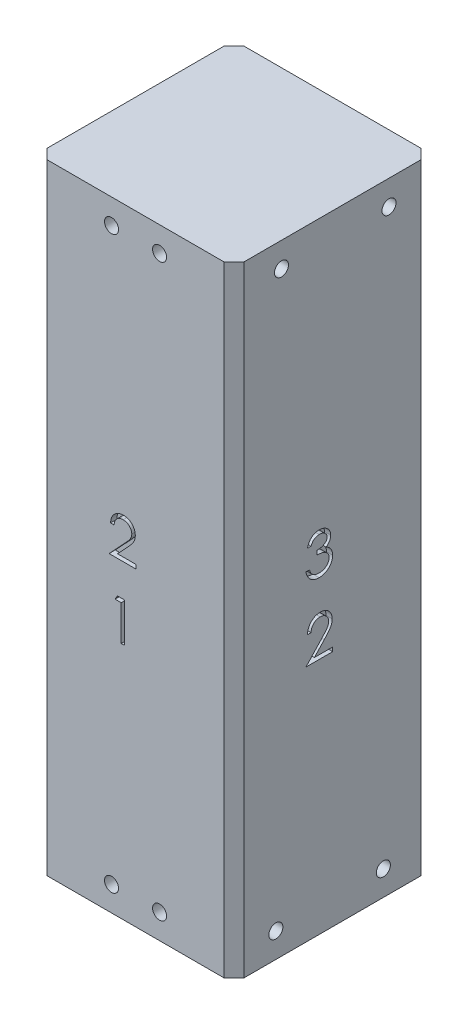
from build123d import *

# Parameters (mm, degrees)
SKETCH1_W           = 31.75
SKETCH1_H           = 31.75
BOSS_EXTRUDE1_DEPTH = 100
CHAMFER1_SIZE       = 1.5875
CUT_EXTRUDE1_DEPTH  = 1
CUT_EXTRUDE2_DEPTH  = 1
CUT_EXTRUDE3_DEPTH  = 1
CUT_EXTRUDE4_DEPTH  = 1
SKETCH6_R           = 1.1303
SKETCH6_R_2         = 0.889
CUT_EXTRUDE5_DEPTH  = 7
SKETCH7_R           = 1.1303
CUT_EXTRUDE6_DEPTH  = 7
SKETCH8_R           = 1.1303
CUT_EXTRUDE7_DEPTH  = 7
CUT_EXTRUDE8_START  = -7
SKETCH9_R           = 1.1303
SKETCH9_R_2         = 0.889
CUT_EXTRUDE8_DEPTH  = 7


with BuildPart() as part:
    # Sketch1 → Boss-Extrude1 (new body)
    with BuildSketch(Plane(origin=(0, 0, 0), x_dir=(1, 0, 0), z_dir=(0, 1, 0))):
        Rectangle(SKETCH1_W, SKETCH1_H)
    extrude(amount=BOSS_EXTRUDE1_DEPTH)

    # Chamfer1
    chamfer1_edges = [part.edges().sort_by_distance(p)[0] for p in [
        (15.875, 50, 15.875),
        (-15.875, 50, 15.875),
        (-15.875, 50, -15.875),
        (15.875, 50, -15.875),
    ]]
    chamfer(chamfer1_edges, length=CHAMFER1_SIZE)

    # Sketch2 → Cut-Extrude1 (cut)
    # profile 1 of 2: a face of its own
    with BuildSketch(Plane.ZY.offset(15.875)):
        Polygon((-2.924409054, 56.35), (-1.750320513, 56.35), (-1.750320513, 50), (-2.320192308, 50), (-2.320192308, 55.698717949), (-3.297115385, 55.698717949), align=None)
    # profile 2 of 2: a face of its own
    with BuildSketch(Plane.ZY.offset(15.875)):
        Polygon((-0.807742388, 44.929487179), (-0.691987179, 44.929487179), (-0.691987179, 40.533333333), (0.040705128, 40.533333333), (0.040705128, 39.882051282), (-0.691987179, 39.882051282), (-0.691987179, 38.416666667), (-1.261858974, 38.416666667), (-1.261858974, 39.882051282), (-4.274038462, 39.882051282), align=None)
        Polygon((-1.261858974, 40.533333333), (-1.261858974, 43.291105769), (-3.154647436, 40.533333333), align=None, mode=Mode.SUBTRACT)
    extrude(amount=-CUT_EXTRUDE1_DEPTH, mode=Mode.SUBTRACT)

    # Sketch3 → Cut-Extrude2 (cut)
    with BuildSketch(Plane.XY.offset(15.875)):
        with BuildLine():
            Line((-3.459935897, 54.396153846), (-4.029807692, 54.396153846))
            add(Edge.make_bspline(
                [(-4.029807692, 54.396153846), (-4.026093572, 54.471756743), (-4.018799138, 54.620238819), (-3.984639242, 54.836726478), (-3.935760793, 55.04365447), (-3.866652012, 55.239361314), (-3.780824908, 55.425577435), (-3.67790043, 55.601563178), (-3.555991587, 55.766647192), (-3.417730798, 55.919299093), (-3.267564839, 56.0593394), (-3.105538349, 56.180271055), (-2.935276656, 56.282447402), (-2.757296318, 56.367866226), (-2.569589296, 56.431982804), (-2.373858968, 56.47955635), (-2.169245392, 56.508179149), (-2.029835638, 56.511255788), (-1.958934295, 56.512820513)],
                knots=[0, 0, 0, 0, 1.10065271, 2.161652631, 3.183658789, 4.190468796, 5.17591951, 6.163126047, 7.15150782, 8.156236427, 9.156009102, 10.134482811, 11.092018607, 12.041330605, 13.001268258, 13.972401359, 14.968799086, 16, 16, 16, 16], degree=3))
            add(Edge.make_bspline(
                [(-1.958934295, 56.512820513), (-1.889305503, 56.511190456), (-1.752487415, 56.507987453), (-1.552803475, 56.480481014), (-1.362707526, 56.437399726), (-1.18257115, 56.376956043), (-1.013831575, 56.295704296), (-0.855221195, 56.19810019), (-0.704851724, 56.085215639), (-0.569493702, 55.952312291), (-0.445200472, 55.810430822), (-0.337972095, 55.658959912), (-0.246145356, 55.50251535), (-0.169604851, 55.339904185), (-0.113260142, 55.169595319), (-0.070482536, 54.994068251), (-0.046302799, 54.811506094), (-0.042591817, 54.687941343), (-0.040705128, 54.625120192)],
                knots=[0, 0, 0, 0, 1.111607364, 2.184268762, 3.212621178, 4.221274766, 5.211760367, 6.196651075, 7.1921475, 8.207485113, 9.220403448, 10.201281604, 11.166441695, 12.114753415, 13.065576456, 14.026450734, 14.996634279, 16, 16, 16, 16], degree=3))
            add(Edge.make_bspline(
                [(-0.040705128, 54.625120192), (-0.043777191, 54.536677692), (-0.049867406, 54.361344733), (-0.101963489, 54.103689197), (-0.183327873, 53.854055422), (-0.281294506, 53.653146317), (-0.380123084, 53.491251264), (-0.469181847, 53.357958042), (-0.573439433, 53.214438121), (-0.694413279, 53.061172094), (-0.829600919, 52.896959452), (-0.980226844, 52.721899395), (-1.147365161, 52.537800613), (-1.264674155, 52.41206045), (-1.325460737, 52.346905048)],
                knots=[0, 0, 0, 0, 1.184426356, 2.348067706, 3.509069118, 4.696110526, 5.333549288, 6.050745305, 6.844228056, 7.710549037, 8.667450064, 9.695053472, 10.805634456, 12, 12, 12, 12], degree=3))
            Line((-1.325460737, 52.346905048), (-2.914232772, 50.651282051))
            Line((-2.914232772, 50.651282051), (0.040705128, 50.651282051))
            Line((0.040705128, 50.651282051), (0.040705128, 50))
            Line((0.040705128, 50), (-4.274038462, 50))
            Line((-4.274038462, 50), (-1.811378205, 52.62802484))
            add(Edge.make_bspline(
                [(-1.811378205, 52.62802484), (-1.751419896, 52.690614624), (-1.636252256, 52.810836792), (-1.473361009, 52.986356162), (-1.327058845, 53.149187472), (-1.196398718, 53.299023067), (-1.084215072, 53.438054626), (-0.984661166, 53.561779302), (-0.904895022, 53.675633805), (-0.818325661, 53.807606061), (-0.734480295, 53.96873698), (-0.662430735, 54.165648102), (-0.618498081, 54.36835326), (-0.61322788, 54.505335527), (-0.610576923, 54.574238782)],
                knots=[0, 0, 0, 0, 1.329631726, 2.553950428, 3.673215718, 4.687767853, 5.603093632, 6.413772471, 7.123043292, 7.734684054, 8.834405432, 9.900288307, 10.943827018, 12, 12, 12, 12], degree=3))
            add(Edge.make_bspline(
                [(-0.610576923, 54.574238782), (-0.611730341, 54.617566462), (-0.614003507, 54.702956999), (-0.63406533, 54.828153162), (-0.664382962, 54.948920753), (-0.707826502, 55.065631247), (-0.765170159, 55.177111216), (-0.834971862, 55.283496359), (-0.91550812, 55.386346338), (-1.008673995, 55.482781608), (-1.111020609, 55.571103223), (-1.219141605, 55.649342636), (-1.333532508, 55.714727879), (-1.453711016, 55.768328224), (-1.579342081, 55.810374987), (-1.71066869, 55.839509839), (-1.847327977, 55.857802345), (-1.940643034, 55.860277343), (-1.988191106, 55.861538462)],
                knots=[0, 0, 0, 0, 0.991446411, 1.95395049, 2.89581595, 3.838931463, 4.798493298, 5.75982156, 6.748411868, 7.785213223, 8.824556874, 9.840280684, 10.836137867, 11.835679398, 12.848801643, 13.863922112, 14.911575587, 16, 16, 16, 16], degree=3))
            add(Edge.make_bspline(
                [(-1.988191106, 55.861538462), (-2.037849617, 55.860241189), (-2.135370733, 55.857693559), (-2.278552407, 55.83987244), (-2.415142317, 55.809127844), (-2.545484056, 55.767078735), (-2.669798161, 55.71363251), (-2.78748007, 55.647063202), (-2.898265597, 55.567627436), (-3.002363004, 55.477565284), (-3.098273366, 55.377294065), (-3.182541269, 55.265515989), (-3.256172266, 55.144271964), (-3.320414733, 55.013889136), (-3.372585771, 54.873184421), (-3.412451344, 54.722657299), (-3.443996051, 54.562961365), (-3.454534367, 54.452679853), (-3.459935897, 54.396153846)],
                knots=[0, 0, 0, 0, 1.031018746, 2.02475058, 2.990194455, 3.934040569, 4.864654155, 5.795059489, 6.735614925, 7.690564532, 8.649604399, 9.611025574, 10.590972636, 11.591080095, 12.624614302, 13.701020113, 14.821632451, 16, 16, 16, 16], degree=3))
        make_face()
        Polygon((-2.924409054, 44.766666667), (-1.750320513, 44.766666667), (-1.750320513, 38.416666667), (-2.320192308, 38.416666667), (-2.320192308, 44.115384615), (-3.297115385, 44.115384615), align=None)
    extrude(amount=-CUT_EXTRUDE2_DEPTH, mode=Mode.SUBTRACT)

    # Sketch4 → Cut-Extrude3 (cut)
    with BuildSketch(Plane(origin=(15.875, 0, 0), x_dir=(0, 0, -1), z_dir=(1, 0, 0))):
        with BuildLine():
            Line((-3.459935897, 54.884615385), (-4.029807692, 54.884615385))
            add(Edge.make_bspline(
                [(-4.029807692, 54.884615385), (-4.014368936, 54.948537177), (-3.98418743, 55.073499053), (-3.921236119, 55.25203794), (-3.85265747, 55.420990615), (-3.770308666, 55.577193491), (-3.68048564, 55.723785786), (-3.577574417, 55.857442626), (-3.46632292, 55.981563292), (-3.343269084, 56.091714452), (-3.214221369, 56.191459761), (-3.077361416, 56.276504507), (-2.935442738, 56.349664042), (-2.787482053, 56.409935034), (-2.633038856, 56.455338484), (-2.473509397, 56.488280117), (-2.308475618, 56.509672567), (-2.196447847, 56.51176038), (-2.139563301, 56.512820513)],
                knots=[0, 0, 0, 0, 1.162005537, 2.271625781, 3.343758855, 4.383309926, 5.390229558, 6.379919256, 7.361854164, 8.333198761, 9.295911338, 10.242430842, 11.177959212, 12.116337295, 13.062827104, 14.020064771, 14.994644689, 16, 16, 16, 16], degree=3))
            add(Edge.make_bspline(
                [(-2.139563301, 56.512820513), (-2.056681755, 56.510318195), (-1.892726549, 56.505368142), (-1.65185645, 56.460166236), (-1.419579221, 56.388637782), (-1.1984373, 56.289806877), (-0.993026715, 56.167909894), (-0.810262491, 56.022831015), (-0.652621907, 55.857369425), (-0.520370679, 55.674611772), (-0.416820323, 55.47929392), (-0.340463617, 55.278270777), (-0.293978567, 55.072019201), (-0.287954128, 54.932759566), (-0.284935897, 54.862990785)],
                knots=[0, 0, 0, 0, 1.083050992, 2.142477498, 3.193116406, 4.255571735, 5.30263384, 6.308962982, 7.297363603, 8.282367274, 9.249857812, 10.179914175, 11.08814088, 12, 12, 12, 12], degree=3))
            add(Edge.make_bspline(
                [(-0.284935897, 54.862990785), (-0.287046984, 54.795849886), (-0.291178053, 54.664465566), (-0.326254919, 54.472656564), (-0.385284996, 54.291878232), (-0.467054422, 54.121369552), (-0.572902663, 53.962211629), (-0.701123128, 53.814046369), (-0.852620814, 53.676216611), (-0.967426887, 53.597259853), (-1.026532452, 53.556610577)],
                knots=[0, 0, 0, 0, 1.024540389, 2.004866551, 2.965041327, 3.920577974, 4.882998113, 5.874504559, 6.905732034, 8, 8, 8, 8], degree=3))
            add(Edge.make_bspline(
                [(-1.026532452, 53.556610577), (-0.958983411, 53.523993037), (-0.825149225, 53.459368257), (-0.642721836, 53.332629954), (-0.477117691, 53.186296295), (-0.384763801, 53.072100339), (-0.338361378, 53.014723558)],
                knots=[0, 0, 0, 0, 1.015518401, 2.012035669, 3.001164323, 4, 4, 4, 4], degree=3))
            add(Edge.make_bspline(
                [(-0.338361378, 53.014723558), (-0.307806371, 52.972890208), (-0.247196717, 52.88990856), (-0.172383677, 52.756492473), (-0.104512856, 52.621597628), (-0.051626029, 52.48160842), (-0.010670585, 52.338147381), (0.018604788, 52.190968176), (0.036791443, 52.039950621), (0.039395945, 51.937783693), (0.040705128, 51.886428285)],
                knots=[0, 0, 0, 0, 1.025084078, 2.033381695, 3.024893161, 4.013698104, 4.991890475, 5.976764909, 6.982997093, 8, 8, 8, 8], degree=3))
            add(Edge.make_bspline(
                [(0.040705128, 51.886428285), (0.037449368, 51.797510648), (0.030953169, 51.620093822), (-0.027111366, 51.357975399), (-0.11712396, 51.101751987), (-0.244952972, 50.856687636), (-0.400741166, 50.627397516), (-0.58608374, 50.422244784), (-0.798874796, 50.245898745), (-1.036193616, 50.098560188), (-1.293308977, 49.980780529), (-1.568310409, 49.899033454), (-1.857235506, 49.845791427), (-2.055368746, 49.840082107), (-2.15609976, 49.837179487)],
                knots=[0, 0, 0, 0, 0.955779014, 1.907060117, 2.875433937, 3.871313158, 4.872415639, 5.851225146, 6.836215519, 7.83643374, 8.849228613, 9.86973379, 10.916971861, 12, 12, 12, 12], degree=3))
            add(Edge.make_bspline(
                [(-2.15609976, 49.837179487), (-2.223989062, 49.838754674), (-2.357572569, 49.841854117), (-2.553957202, 49.863042436), (-2.741412285, 49.90174116), (-2.92019127, 49.953817157), (-3.090452979, 50.019842174), (-3.251677855, 50.102063241), (-3.404857805, 50.198785537), (-3.548547331, 50.311150761), (-3.682729304, 50.436846906), (-3.803837817, 50.578105396), (-3.913892013, 50.732314971), (-4.009945086, 50.901266802), (-4.096372129, 51.082777483), (-4.167457579, 51.279171187), (-4.230024253, 51.488692198), (-4.259113539, 51.634701813), (-4.274038462, 51.709615385)],
                knots=[0, 0, 0, 0, 1.048658725, 2.063410685, 3.046034179, 4.001477787, 4.936774919, 5.862367409, 6.792675028, 7.730719943, 8.675894397, 9.627829632, 10.600096036, 11.597688215, 12.626045268, 13.701542398, 14.82072376, 16, 16, 16, 16], degree=3))
            Line((-4.274038462, 51.709615385), (-3.704166667, 51.709615385))
            add(Edge.make_bspline(
                [(-3.704166667, 51.709615385), (-3.689319838, 51.660722175), (-3.660441466, 51.565620635), (-3.611284669, 51.428750366), (-3.555280803, 51.303277898), (-3.495201533, 51.188282805), (-3.432103495, 51.082632589), (-3.361500702, 50.989120913), (-3.288622396, 50.903640474), (-3.233686998, 50.855480964), (-3.206800881, 50.831911058)],
                knots=[0, 0, 0, 0, 1.198163088, 2.33053128, 3.407730985, 4.417276592, 5.372219308, 6.28897303, 7.162600585, 8, 8, 8, 8], degree=3))
            add(Edge.make_bspline(
                [(-3.206800881, 50.831911058), (-3.171247093, 50.804500223), (-3.100249261, 50.749763166), (-2.984555471, 50.679910211), (-2.862880606, 50.619383779), (-2.732588268, 50.573149074), (-2.596490042, 50.534001033), (-2.452386108, 50.508382376), (-2.301547814, 50.490805266), (-2.198554872, 50.489254176), (-2.145923478, 50.488461538)],
                knots=[0, 0, 0, 0, 0.946170439, 1.889420265, 2.845303464, 3.807233317, 4.801018734, 5.828864929, 6.890507805, 8, 8, 8, 8], degree=3))
            add(Edge.make_bspline(
                [(-2.145923478, 50.488461538), (-2.086499266, 50.489578967), (-1.970300349, 50.491764001), (-1.800746533, 50.511858497), (-1.639443021, 50.541123676), (-1.488180713, 50.586322945), (-1.344978221, 50.642168204), (-1.211842942, 50.712287454), (-1.087027149, 50.794555735), (-0.972129514, 50.888062494), (-0.868814093, 50.990427206), (-0.777846691, 51.097493778), (-0.700513376, 51.208810783), (-0.638131741, 51.324994231), (-0.588872886, 51.445563003), (-0.555339079, 51.570855451), (-0.532022759, 51.699846205), (-0.530123905, 51.787528763), (-0.529166667, 51.831730769)],
                knots=[0, 0, 0, 0, 1.217147791, 2.380027433, 3.494444702, 4.572153297, 5.609568379, 6.639424714, 7.649109417, 8.668170816, 9.669597737, 10.625200337, 11.543417969, 12.441394052, 13.322311151, 14.205496177, 15.095365482, 16, 16, 16, 16], degree=3))
            add(Edge.make_bspline(
                [(-0.529166667, 51.831730769), (-0.531943071, 51.890897055), (-0.537482064, 52.008935225), (-0.579770487, 52.182594252), (-0.649328141, 52.349913872), (-0.746705411, 52.508039377), (-0.86524309, 52.654589941), (-1.00379085, 52.785348202), (-1.163499207, 52.893243939), (-1.310492398, 52.967790501), (-1.440694896, 53.018657766), (-1.552119951, 53.052539487), (-1.676864074, 53.081229977), (-1.813418736, 53.107922241), (-1.962812857, 53.130639544), (-2.124883794, 53.149583981), (-2.29966439, 53.164742413), (-2.42066122, 53.171511685), (-2.483012821, 53.175)],
                knots=[0, 0, 0, 0, 1.07054697, 2.135767047, 3.216561865, 4.33974944, 5.486079747, 6.621378074, 7.775625952, 8.963672916, 9.598146892, 10.304877434, 11.070270905, 11.915000392, 12.823868403, 13.805723172, 14.86925407, 16, 16, 16, 16], degree=3))
            Line((-2.483012821, 53.175), (-2.483012821, 53.826282051))
            add(Edge.make_bspline(
                [(-2.483012821, 53.826282051), (-2.404452134, 53.827615195), (-2.250571048, 53.830226497), (-2.025791381, 53.861809601), (-1.810846943, 53.905498741), (-1.610501283, 53.972419018), (-1.42789576, 54.050143557), (-1.269473053, 54.140589708), (-1.137452658, 54.241127896), (-1.032476142, 54.353309916), (-0.953501685, 54.473624359), (-0.895758781, 54.599021724), (-0.861649617, 54.730601092), (-0.857096364, 54.820398561), (-0.854807692, 54.865534856)],
                knots=[0, 0, 0, 0, 1.321986639, 2.589447074, 3.816329219, 5.01088745, 6.139805852, 7.153945165, 8.075214402, 8.924034688, 9.728124013, 10.488707548, 11.240355623, 12, 12, 12, 12], degree=3))
            add(Edge.make_bspline(
                [(-0.854807692, 54.865534856), (-0.855559552, 54.898695908), (-0.857055342, 54.964668248), (-0.875918974, 55.061052301), (-0.904265449, 55.154489731), (-0.943235815, 55.244583187), (-0.99539689, 55.330707827), (-1.057819179, 55.413597913), (-1.132147018, 55.492780198), (-1.217319472, 55.56658592), (-1.30878089, 55.636924393), (-1.409019767, 55.696639135), (-1.51501374, 55.747702319), (-1.626880157, 55.789810987), (-1.744982048, 55.821487124), (-1.868764516, 55.844230722), (-1.998463599, 55.858450467), (-2.086949456, 55.860497736), (-2.13193109, 55.861538462)],
                knots=[0, 0, 0, 0, 0.884392785, 1.759457502, 2.611959086, 3.489218968, 4.37281399, 5.2945488, 6.255912374, 7.266815255, 8.301784654, 9.332968512, 10.37626691, 11.440494194, 12.520033166, 13.637162961, 14.798855837, 16, 16, 16, 16], degree=3))
            add(Edge.make_bspline(
                [(-2.13193109, 55.861538462), (-2.204233402, 55.859014133), (-2.345456633, 55.854083533), (-2.549046554, 55.810898066), (-2.738311631, 55.741994972), (-2.882980355, 55.659747922), (-2.989810168, 55.578557849), (-3.066149756, 55.507651234), (-3.141116968, 55.428851682), (-3.209779838, 55.337305773), (-3.279219768, 55.239213168), (-3.342437758, 55.129587346), (-3.403868914, 55.011287945), (-3.440884968, 54.927657293), (-3.459935897, 54.884615385)],
                knots=[0, 0, 0, 0, 1.472543308, 2.876219568, 4.221790263, 5.565193594, 6.249813518, 6.953379497, 7.687249741, 8.463570142, 9.283606569, 10.136032583, 11.040678096, 12, 12, 12, 12], degree=3))
        make_face()
        with BuildLine():
            Line((-3.459935897, 42.812820513), (-4.029807692, 42.812820513))
            add(Edge.make_bspline(
                [(-4.029807692, 42.812820513), (-4.026093572, 42.888423409), (-4.018799138, 43.036905486), (-3.984639242, 43.253393144), (-3.935760793, 43.460321136), (-3.866652012, 43.65602798), (-3.780824908, 43.842244102), (-3.67790043, 44.018229845), (-3.555991587, 44.183313859), (-3.417730798, 44.33596576), (-3.267564839, 44.476006067), (-3.105538349, 44.596937722), (-2.935276656, 44.699114068), (-2.757296318, 44.784532893), (-2.569589296, 44.84864947), (-2.373858968, 44.896223017), (-2.169245392, 44.924845815), (-2.029835638, 44.927922455), (-1.958934295, 44.929487179)],
                knots=[0, 0, 0, 0, 1.10065271, 2.161652631, 3.183658789, 4.190468796, 5.17591951, 6.163126047, 7.15150782, 8.156236427, 9.156009102, 10.134482811, 11.092018607, 12.041330605, 13.001268258, 13.972401359, 14.968799086, 16, 16, 16, 16], degree=3))
            add(Edge.make_bspline(
                [(-1.958934295, 44.929487179), (-1.889305503, 44.927857123), (-1.752487415, 44.92465412), (-1.552803475, 44.897147681), (-1.362707526, 44.854066393), (-1.18257115, 44.793622709), (-1.013831575, 44.712370962), (-0.855221195, 44.614766857), (-0.704851724, 44.501882305), (-0.569493702, 44.368978958), (-0.445200472, 44.227097489), (-0.337972095, 44.075626578), (-0.246145356, 43.919182017), (-0.169604851, 43.756570851), (-0.113260142, 43.586261985), (-0.070482536, 43.410734918), (-0.046302799, 43.22817276), (-0.042591817, 43.10460801), (-0.040705128, 43.041786859)],
                knots=[0, 0, 0, 0, 1.111607364, 2.184268762, 3.212621178, 4.221274766, 5.211760367, 6.196651075, 7.1921475, 8.207485113, 9.220403448, 10.201281604, 11.166441695, 12.114753415, 13.065576456, 14.026450734, 14.996634279, 16, 16, 16, 16], degree=3))
            add(Edge.make_bspline(
                [(-0.040705128, 43.041786859), (-0.043777191, 42.953344359), (-0.049867406, 42.7780114), (-0.101963489, 42.520355863), (-0.183327873, 42.270722089), (-0.281294506, 42.069812983), (-0.380123084, 41.907917931), (-0.469181847, 41.774624709), (-0.573439433, 41.631104788), (-0.694413279, 41.477838761), (-0.829600919, 41.313626119), (-0.980226844, 41.138566062), (-1.147365161, 40.954467279), (-1.264674155, 40.828727117), (-1.325460737, 40.763571715)],
                knots=[0, 0, 0, 0, 1.184426356, 2.348067706, 3.509069118, 4.696110526, 5.333549288, 6.050745305, 6.844228056, 7.710549037, 8.667450064, 9.695053472, 10.805634456, 12, 12, 12, 12], degree=3))
            Line((-1.325460737, 40.763571715), (-2.914232772, 39.067948718))
            Line((-2.914232772, 39.067948718), (0.040705128, 39.067948718))
            Line((0.040705128, 39.067948718), (0.040705128, 38.416666667))
            Line((0.040705128, 38.416666667), (-4.274038462, 38.416666667))
            Line((-4.274038462, 38.416666667), (-1.811378205, 41.044691506))
            add(Edge.make_bspline(
                [(-1.811378205, 41.044691506), (-1.751419896, 41.107281291), (-1.636252256, 41.227503458), (-1.473361009, 41.403022829), (-1.327058845, 41.565854138), (-1.196398718, 41.715689733), (-1.084215072, 41.854721292), (-0.984661166, 41.978445969), (-0.904895022, 42.092300471), (-0.818325661, 42.224272728), (-0.734480295, 42.385403646), (-0.662430735, 42.582314768), (-0.618498081, 42.785019927), (-0.61322788, 42.922002194), (-0.610576923, 42.990905449)],
                knots=[0, 0, 0, 0, 1.329631726, 2.553950428, 3.673215718, 4.687767853, 5.603093632, 6.413772471, 7.123043292, 7.734684054, 8.834405432, 9.900288307, 10.943827018, 12, 12, 12, 12], degree=3))
            add(Edge.make_bspline(
                [(-0.610576923, 42.990905449), (-0.611730341, 43.034233129), (-0.614003507, 43.119623666), (-0.63406533, 43.244819829), (-0.664382962, 43.365587419), (-0.707826502, 43.482297914), (-0.765170159, 43.593777883), (-0.834971862, 43.700163025), (-0.91550812, 43.803013005), (-1.008673995, 43.899448274), (-1.111020609, 43.98776989), (-1.219141605, 44.066009302), (-1.333532508, 44.131394546), (-1.453711016, 44.184994891), (-1.579342081, 44.227041654), (-1.71066869, 44.256176505), (-1.847327977, 44.274469012), (-1.940643034, 44.276944009), (-1.988191106, 44.278205128)],
                knots=[0, 0, 0, 0, 0.991446411, 1.95395049, 2.89581595, 3.838931463, 4.798493298, 5.75982156, 6.748411868, 7.785213223, 8.824556874, 9.840280684, 10.836137867, 11.835679398, 12.848801643, 13.863922112, 14.911575587, 16, 16, 16, 16], degree=3))
            add(Edge.make_bspline(
                [(-1.988191106, 44.278205128), (-2.037849617, 44.276907855), (-2.135370733, 44.274360226), (-2.278552407, 44.256539107), (-2.415142317, 44.225794511), (-2.545484056, 44.183745401), (-2.669798161, 44.130299177), (-2.78748007, 44.063729869), (-2.898265597, 43.984294103), (-3.002363004, 43.894231951), (-3.098273366, 43.793960731), (-3.182541269, 43.682182655), (-3.256172266, 43.56093863), (-3.320414733, 43.430555803), (-3.372585771, 43.289851088), (-3.412451344, 43.139323966), (-3.443996051, 42.979628031), (-3.454534367, 42.86934652), (-3.459935897, 42.812820513)],
                knots=[0, 0, 0, 0, 1.031018746, 2.02475058, 2.990194455, 3.934040569, 4.864654155, 5.795059489, 6.735614925, 7.690564532, 8.649604399, 9.611025574, 10.590972636, 11.591080095, 12.624614302, 13.701020113, 14.821632451, 16, 16, 16, 16], degree=3))
        make_face()
    extrude(amount=-CUT_EXTRUDE3_DEPTH, mode=Mode.SUBTRACT)

    # Sketch5 → Cut-Extrude4 (cut)
    # profile 1 of 2: a face of its own
    with BuildSketch(Plane(origin=(0, 0, -15.875), x_dir=(-1, 0, 0), z_dir=(0, 0, -1))):
        Polygon((-0.807742388, 56.512820513), (-0.691987179, 56.512820513), (-0.691987179, 52.116666667), (0.040705128, 52.116666667), (0.040705128, 51.465384615), (-0.691987179, 51.465384615), (-0.691987179, 50), (-1.261858974, 50), (-1.261858974, 51.465384615), (-4.274038462, 51.465384615), align=None)
        Polygon((-1.261858974, 52.116666667), (-1.261858974, 54.874439103), (-3.154647436, 52.116666667), align=None, mode=Mode.SUBTRACT)
    # profile 2 of 2: a face of its own
    with BuildSketch(Plane(origin=(0, 0, -15.875), x_dir=(-1, 0, 0), z_dir=(0, 0, -1))):
        with BuildLine():
            Line((-3.459935897, 43.301282051), (-4.029807692, 43.301282051))
            add(Edge.make_bspline(
                [(-4.029807692, 43.301282051), (-4.014368936, 43.365203844), (-3.98418743, 43.490165719), (-3.921236119, 43.668704607), (-3.85265747, 43.837657281), (-3.770308666, 43.993860158), (-3.68048564, 44.140452453), (-3.577574417, 44.274109293), (-3.46632292, 44.398229959), (-3.343269084, 44.508381118), (-3.214221369, 44.608126427), (-3.077361416, 44.693171174), (-2.935442738, 44.766330709), (-2.787482053, 44.826601701), (-2.633038856, 44.872005151), (-2.473509397, 44.904946784), (-2.308475618, 44.926339234), (-2.196447847, 44.928427047), (-2.139563301, 44.929487179)],
                knots=[0, 0, 0, 0, 1.162005537, 2.271625781, 3.343758855, 4.383309926, 5.390229558, 6.379919256, 7.361854164, 8.333198761, 9.295911338, 10.242430842, 11.177959212, 12.116337295, 13.062827104, 14.020064771, 14.994644689, 16, 16, 16, 16], degree=3))
            add(Edge.make_bspline(
                [(-2.139563301, 44.929487179), (-2.056681755, 44.926984862), (-1.892726549, 44.922034809), (-1.65185645, 44.876832903), (-1.419579221, 44.805304449), (-1.1984373, 44.706473544), (-0.993026715, 44.584576561), (-0.810262491, 44.439497681), (-0.652621907, 44.274036091), (-0.520370679, 44.091278439), (-0.416820323, 43.895960586), (-0.340463617, 43.694937444), (-0.293978567, 43.488685867), (-0.287954128, 43.349426232), (-0.284935897, 43.279657452)],
                knots=[0, 0, 0, 0, 1.083050992, 2.142477498, 3.193116406, 4.255571735, 5.30263384, 6.308962982, 7.297363603, 8.282367274, 9.249857812, 10.179914175, 11.08814088, 12, 12, 12, 12], degree=3))
            add(Edge.make_bspline(
                [(-0.284935897, 43.279657452), (-0.287046984, 43.212516553), (-0.291178053, 43.081132233), (-0.326254919, 42.889323231), (-0.385284996, 42.708544899), (-0.467054422, 42.538036219), (-0.572902663, 42.378878295), (-0.701123128, 42.230713036), (-0.852620814, 42.092883278), (-0.967426887, 42.01392652), (-1.026532452, 41.973277244)],
                knots=[0, 0, 0, 0, 1.024540389, 2.004866551, 2.965041327, 3.920577974, 4.882998113, 5.874504559, 6.905732034, 8, 8, 8, 8], degree=3))
            add(Edge.make_bspline(
                [(-1.026532452, 41.973277244), (-0.958983411, 41.940659704), (-0.825149225, 41.876034924), (-0.642721836, 41.749296621), (-0.477117691, 41.602962962), (-0.384763801, 41.488767006), (-0.338361378, 41.431390224)],
                knots=[0, 0, 0, 0, 1.015518401, 2.012035669, 3.001164323, 4, 4, 4, 4], degree=3))
            add(Edge.make_bspline(
                [(-0.338361378, 41.431390224), (-0.307806371, 41.389556875), (-0.247196717, 41.306575226), (-0.172383677, 41.173159139), (-0.104512856, 41.038264295), (-0.051626029, 40.898275087), (-0.010670585, 40.754814047), (0.018604788, 40.607634843), (0.036791443, 40.456617288), (0.039395945, 40.35445036), (0.040705128, 40.303094952)],
                knots=[0, 0, 0, 0, 1.025084078, 2.033381695, 3.024893161, 4.013698104, 4.991890475, 5.976764909, 6.982997093, 8, 8, 8, 8], degree=3))
            add(Edge.make_bspline(
                [(0.040705128, 40.303094952), (0.037449368, 40.214177315), (0.030953169, 40.036760489), (-0.027111366, 39.774642065), (-0.11712396, 39.518418654), (-0.244952972, 39.273354303), (-0.400741166, 39.044064183), (-0.58608374, 38.838911451), (-0.798874796, 38.662565411), (-1.036193616, 38.515226855), (-1.293308977, 38.397447196), (-1.568310409, 38.315700121), (-1.857235506, 38.262458093), (-2.055368746, 38.256748774), (-2.15609976, 38.253846154)],
                knots=[0, 0, 0, 0, 0.955779014, 1.907060117, 2.875433937, 3.871313158, 4.872415639, 5.851225146, 6.836215519, 7.83643374, 8.849228613, 9.86973379, 10.916971861, 12, 12, 12, 12], degree=3))
            add(Edge.make_bspline(
                [(-2.15609976, 38.253846154), (-2.223989062, 38.255421341), (-2.357572569, 38.258520783), (-2.553957202, 38.279709103), (-2.741412285, 38.318407826), (-2.92019127, 38.370483823), (-3.090452979, 38.436508841), (-3.251677855, 38.518729908), (-3.404857805, 38.615452204), (-3.548547331, 38.727817428), (-3.682729304, 38.853513573), (-3.803837817, 38.994772062), (-3.913892013, 39.148981638), (-4.009945086, 39.317933468), (-4.096372129, 39.499444149), (-4.167457579, 39.695837854), (-4.230024253, 39.905358865), (-4.259113539, 40.051368479), (-4.274038462, 40.126282051)],
                knots=[0, 0, 0, 0, 1.048658725, 2.063410685, 3.046034179, 4.001477787, 4.936774919, 5.862367409, 6.792675028, 7.730719943, 8.675894397, 9.627829632, 10.600096036, 11.597688215, 12.626045268, 13.701542398, 14.82072376, 16, 16, 16, 16], degree=3))
            Line((-4.274038462, 40.126282051), (-3.704166667, 40.126282051))
            add(Edge.make_bspline(
                [(-3.704166667, 40.126282051), (-3.689319838, 40.077388841), (-3.660441466, 39.982287302), (-3.611284669, 39.845417033), (-3.555280803, 39.719944565), (-3.495201533, 39.604949472), (-3.432103495, 39.499299256), (-3.361500702, 39.405787579), (-3.288622396, 39.320307141), (-3.233686998, 39.272147631), (-3.206800881, 39.248577724)],
                knots=[0, 0, 0, 0, 1.198163088, 2.33053128, 3.407730985, 4.417276592, 5.372219308, 6.28897303, 7.162600585, 8, 8, 8, 8], degree=3))
            add(Edge.make_bspline(
                [(-3.206800881, 39.248577724), (-3.171247093, 39.22116689), (-3.100249261, 39.166429832), (-2.984555471, 39.096576878), (-2.862880606, 39.036050446), (-2.732588268, 38.989815741), (-2.596490042, 38.950667699), (-2.452386108, 38.925049043), (-2.301547814, 38.907471932), (-2.198554872, 38.905920842), (-2.145923478, 38.905128205)],
                knots=[0, 0, 0, 0, 0.946170439, 1.889420265, 2.845303464, 3.807233317, 4.801018734, 5.828864929, 6.890507805, 8, 8, 8, 8], degree=3))
            add(Edge.make_bspline(
                [(-2.145923478, 38.905128205), (-2.086499266, 38.906245633), (-1.970300349, 38.908430667), (-1.800746533, 38.928525164), (-1.639443021, 38.957790343), (-1.488180713, 39.002989612), (-1.344978221, 39.058834871), (-1.211842942, 39.128954121), (-1.087027149, 39.211222401), (-0.972129514, 39.30472916), (-0.868814093, 39.407093873), (-0.777846691, 39.514160445), (-0.700513376, 39.62547745), (-0.638131741, 39.741660898), (-0.588872886, 39.86222967), (-0.555339079, 39.987522118), (-0.532022759, 40.116512872), (-0.530123905, 40.20419543), (-0.529166667, 40.248397436)],
                knots=[0, 0, 0, 0, 1.217147791, 2.380027433, 3.494444702, 4.572153297, 5.609568379, 6.639424714, 7.649109417, 8.668170816, 9.669597737, 10.625200337, 11.543417969, 12.441394052, 13.322311151, 14.205496177, 15.095365482, 16, 16, 16, 16], degree=3))
            add(Edge.make_bspline(
                [(-0.529166667, 40.248397436), (-0.531943071, 40.307563722), (-0.537482064, 40.425601891), (-0.579770487, 40.599260919), (-0.649328141, 40.766580539), (-0.746705411, 40.924706044), (-0.86524309, 41.071256608), (-1.00379085, 41.202014869), (-1.163499207, 41.309910605), (-1.310492398, 41.384457168), (-1.440694896, 41.435324433), (-1.552119951, 41.469206154), (-1.676864074, 41.497896644), (-1.813418736, 41.524588908), (-1.962812857, 41.547306211), (-2.124883794, 41.566250648), (-2.29966439, 41.581409079), (-2.42066122, 41.588178352), (-2.483012821, 41.591666667)],
                knots=[0, 0, 0, 0, 1.07054697, 2.135767047, 3.216561865, 4.33974944, 5.486079747, 6.621378074, 7.775625952, 8.963672916, 9.598146892, 10.304877434, 11.070270905, 11.915000392, 12.823868403, 13.805723172, 14.86925407, 16, 16, 16, 16], degree=3))
            Line((-2.483012821, 41.591666667), (-2.483012821, 42.242948718))
            add(Edge.make_bspline(
                [(-2.483012821, 42.242948718), (-2.404452134, 42.244281862), (-2.250571048, 42.246893163), (-2.025791381, 42.278476268), (-1.810846943, 42.322165407), (-1.610501283, 42.389085685), (-1.42789576, 42.466810223), (-1.269473053, 42.557256375), (-1.137452658, 42.657794563), (-1.032476142, 42.769976583), (-0.953501685, 42.890291026), (-0.895758781, 43.015688391), (-0.861649617, 43.147267758), (-0.857096364, 43.237065227), (-0.854807692, 43.282201522)],
                knots=[0, 0, 0, 0, 1.321986639, 2.589447074, 3.816329219, 5.01088745, 6.139805852, 7.153945165, 8.075214402, 8.924034688, 9.728124013, 10.488707548, 11.240355623, 12, 12, 12, 12], degree=3))
            add(Edge.make_bspline(
                [(-0.854807692, 43.282201522), (-0.855559552, 43.315362574), (-0.857055342, 43.381334914), (-0.875918974, 43.477718968), (-0.904265449, 43.571156398), (-0.943235815, 43.661249854), (-0.99539689, 43.747374494), (-1.057819179, 43.830264579), (-1.132147018, 43.909446864), (-1.217319472, 43.983252587), (-1.30878089, 44.05359106), (-1.409019767, 44.113305801), (-1.51501374, 44.164368985), (-1.626880157, 44.206477654), (-1.744982048, 44.238153791), (-1.868764516, 44.260897389), (-1.998463599, 44.275117134), (-2.086949456, 44.277164403), (-2.13193109, 44.278205128)],
                knots=[0, 0, 0, 0, 0.884392785, 1.759457502, 2.611959086, 3.489218968, 4.37281399, 5.2945488, 6.255912374, 7.266815255, 8.301784654, 9.332968512, 10.37626691, 11.440494194, 12.520033166, 13.637162961, 14.798855837, 16, 16, 16, 16], degree=3))
            add(Edge.make_bspline(
                [(-2.13193109, 44.278205128), (-2.204233402, 44.2756808), (-2.345456633, 44.2707502), (-2.549046554, 44.227564733), (-2.738311631, 44.158661638), (-2.882980355, 44.076414589), (-2.989810168, 43.995224516), (-3.066149756, 43.924317901), (-3.141116968, 43.845518349), (-3.209779838, 43.75397244), (-3.279219768, 43.655879835), (-3.342437758, 43.546254012), (-3.403868914, 43.427954611), (-3.440884968, 43.34432396), (-3.459935897, 43.301282051)],
                knots=[0, 0, 0, 0, 1.472543308, 2.876219568, 4.221790263, 5.565193594, 6.249813518, 6.953379497, 7.687249741, 8.463570142, 9.283606569, 10.136032583, 11.040678096, 12, 12, 12, 12], degree=3))
        make_face()
    extrude(amount=-CUT_EXTRUDE4_DEPTH, mode=Mode.SUBTRACT)

    # Sketch6 → Cut-Extrude5 (cut)
    with BuildSketch(Plane(origin=(-15.875, 23.81610841, -46.177455222), x_dir=(0, 0, 1), z_dir=(-1, 0, 0))):
        with Locations((50.052455222, 72.18389159)):
            Circle(SKETCH6_R)
        with Locations((52.808705222, 56.06389159)):
            Circle(SKETCH6_R_2)
        with Locations((57.608705222, 56.06389159)):
            Circle(SKETCH6_R_2)
        with Locations((50.052455222, -19.81610841)):
            Circle(SKETCH6_R)
        with Locations((42.302455222, 72.18389159)):
            Circle(SKETCH6_R)
        with Locations((42.302455222, -19.81610841)):
            Circle(SKETCH6_R)
    extrude(amount=-CUT_EXTRUDE5_DEPTH, mode=Mode.SUBTRACT)

    # Sketch7 → Cut-Extrude6 (cut)
    with BuildSketch(Plane(origin=(121.220498129, 23.81610841, 15.875), x_dir=(1, 0, 0), z_dir=(0, 0, 1))):
        with Locations((-125.095498129, 72.18389159)):
            Circle(SKETCH7_R)
        with Locations((-117.345498129, 72.18389159)):
            Circle(SKETCH7_R)
        with Locations((-125.095498129, -19.81610841)):
            Circle(SKETCH7_R)
        with Locations((-117.345498129, -19.81610841)):
            Circle(SKETCH7_R)
    extrude(amount=-CUT_EXTRUDE6_DEPTH, mode=Mode.SUBTRACT)

    # Sketch8 → Cut-Extrude7 (cut)
    with BuildSketch(Plane(origin=(15.875, 23.81610841, -46.177455222), x_dir=(0, 0, -1), z_dir=(1, 0, 0))):
        with Locations((-54.389955222, 72.18389159)):
            Circle(SKETCH8_R)
        with Locations((-37.054955222, 72.18389159)):
            Circle(SKETCH8_R)
        with Locations((-55.299955222, -19.81610841)):
            Circle(SKETCH8_R)
        with Locations((-37.964955222, -19.81610841)):
            Circle(SKETCH8_R)
    extrude(amount=-CUT_EXTRUDE7_DEPTH, mode=Mode.SUBTRACT)

    # Sketch9 → Cut-Extrude8 (cut)
    with BuildSketch(Plane(origin=(121.220498129, 23.81610841, -15.875), x_dir=(-1, 0, 0), z_dir=(0, 0, -1)).offset(CUT_EXTRUDE8_START)):
        with Locations(Location((117.345498129, 72.18389159, 0), (0, 0, 180))):
            Circle(SKETCH9_R)
        with Locations(Location((125.095498129, 72.18389159, 0), (0, 0, 180))):
            Circle(SKETCH9_R)
        with Locations((114.589248129, -3.69610841)):
            Circle(SKETCH9_R_2)
        with Locations((109.789248129, -3.69610841)):
            Circle(SKETCH9_R_2)
        with Locations(Location((117.345498129, -19.81610841, 0), (0, 0, 180))):
            Circle(SKETCH9_R)
        with Locations(Location((125.095498129, -19.81610841, 0), (0, 0, 180))):
            Circle(SKETCH9_R)
    extrude(amount=CUT_EXTRUDE8_DEPTH, mode=Mode.SUBTRACT)


solid = part.part
